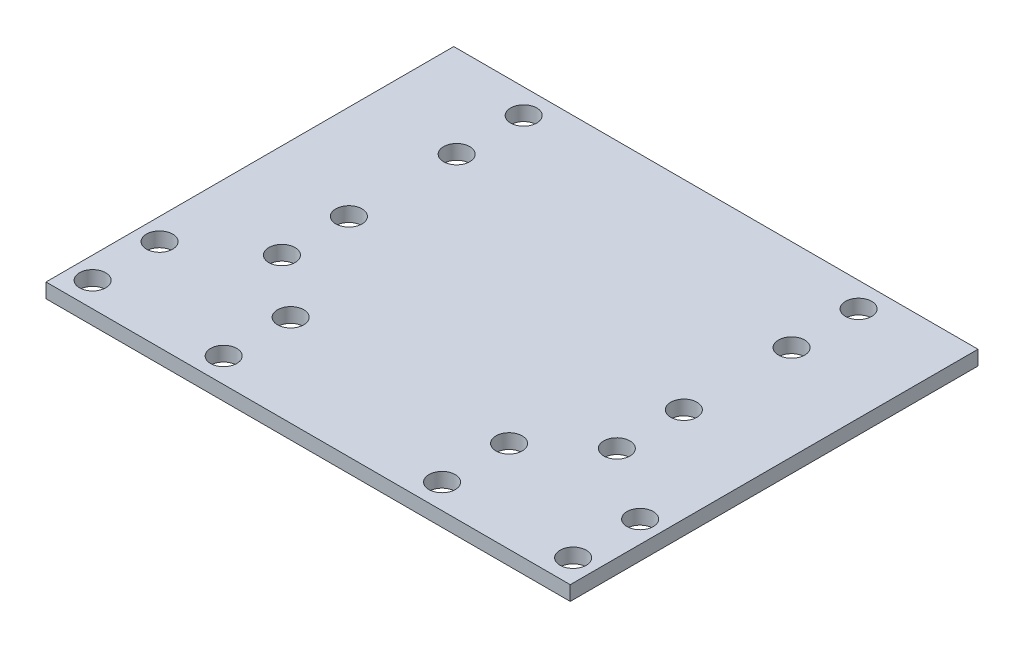
from build123d import *

# Parameters (mm, degrees)
SKETCH1_W   = 180
SKETCH1_H   = 140
BODY_DEPTH  = 5
SKETCH2_R   = 4.5
HOLES_DEPTH = 115.127122105


with BuildPart() as part:
    # Sketch1 → Body (new body)
    with BuildSketch(Plane(origin=(0, 0, 0), x_dir=(1, 0, 0), z_dir=(0, 1, 0))):
        Rectangle(SKETCH1_W, SKETCH1_H)
    extrude(amount=BODY_DEPTH)

    # Sketch2 → Holes (cut, through all)
    with BuildSketch(Plane(origin=(0, 5, 0), x_dir=(1, 0, 0), z_dir=(0, 1, 0))):
        with Locations(Location((-57.5, 61.5, 0), (0, 0, 270))):
            Circle(SKETCH2_R)
        with Locations(Location((-57.5, 38.5, 0), (0, 0, 270))):
            Circle(SKETCH2_R)
        with Locations(Location((-57.5, 1.5, 0), (0, 0, 270))):
            Circle(SKETCH2_R)
        with Locations(Location((-57.5, -21.5, 0), (0, 0, 270))):
            Circle(SKETCH2_R)
        with Locations(Location((-82.5, -38.5, 0), (0, 0, 270))):
            Circle(SKETCH2_R)
        with Locations(Location((-82.5, -61.5, 0), (0, 0, 270))):
            Circle(SKETCH2_R)
        with Locations(Location((-37.5, -61.5, 0), (0, 0, 270))):
            Circle(SKETCH2_R)
        with Locations(Location((-37.5, -38.5, 0), (0, 0, 270))):
            Circle(SKETCH2_R)
        with Locations(Location((37.5, -38.5, 0), (0, 0, 90))):
            Circle(SKETCH2_R)
        with Locations(Location((37.5, -61.5, 0), (0, 0, 90))):
            Circle(SKETCH2_R)
        with Locations(Location((82.5, -61.5, 0), (0, 0, 90))):
            Circle(SKETCH2_R)
        with Locations(Location((82.5, -38.5, 0), (0, 0, 90))):
            Circle(SKETCH2_R)
        with Locations(Location((57.5, -21.5, 0), (0, 0, 90))):
            Circle(SKETCH2_R)
        with Locations(Location((57.5, 1.5, 0), (0, 0, 90))):
            Circle(SKETCH2_R)
        with Locations(Location((57.5, 38.5, 0), (0, 0, 90))):
            Circle(SKETCH2_R)
        with Locations(Location((57.5, 61.5, 0), (0, 0, 90))):
            Circle(SKETCH2_R)
    extrude(amount=-HOLES_DEPTH, mode=Mode.SUBTRACT)


solid = part.part
